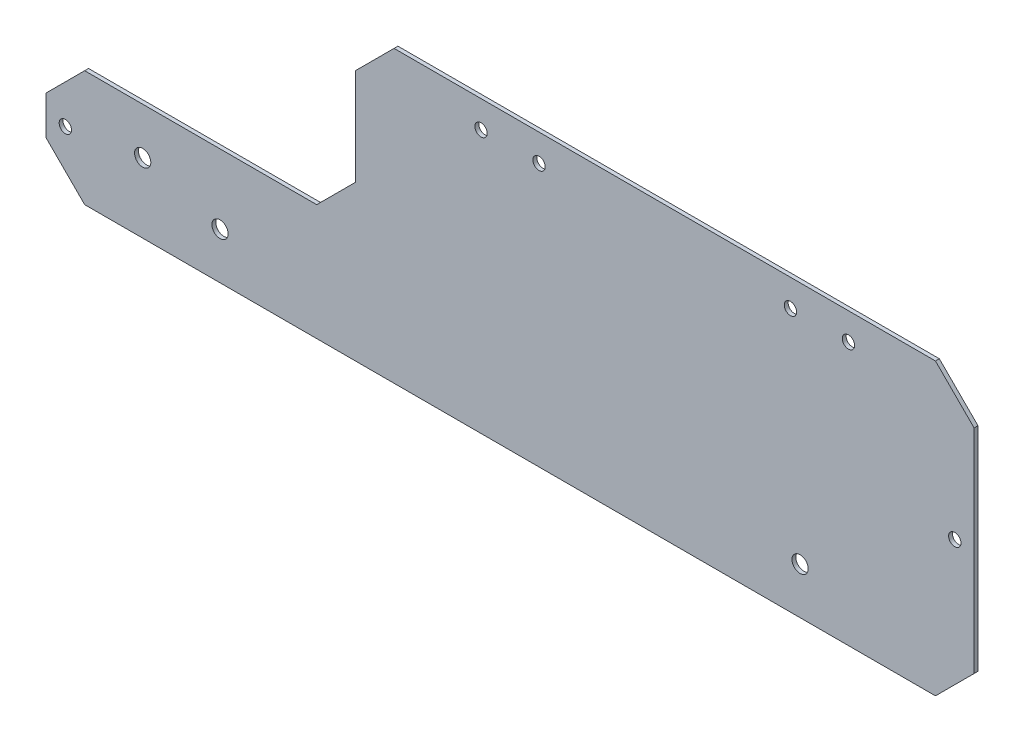
from build123d import *

# Parameters (mm, degrees)
SKETCH_1_W          = 240
SKETCH_1_H          = 75
EXTRUDE_1_DEPTH     = 1
SKETCH_4_W          = 80
SKETCH_4_H          = 45
CUT_EXTRUDE_3_DEPTH = 10
CHAMFER_1_SIZE      = 10
SKETCH_5_R          = 1.6
SKETCH_5_R_2        = 2.1
CUT_EXTRUDE_4_DEPTH = 10


with BuildPart() as part:
    # 草图1 → 凸台-拉伸1 (new body)
    with BuildSketch(Plane.XY):
        with Locations((120, 37.5)):
            Rectangle(SKETCH_1_W, SKETCH_1_H)
    extrude(amount=EXTRUDE_1_DEPTH)

    # 草图4 → 切除-拉伸3 (cut)
    with BuildSketch(Plane(origin=(0, 0, 0), x_dir=(-1, 0, 0), z_dir=(0, 0, -1))):
        with Locations((-40, 52.5)):
            Rectangle(SKETCH_4_W, SKETCH_4_H)
    extrude(amount=-CUT_EXTRUDE_3_DEPTH, mode=Mode.SUBTRACT)

    # 倒角1
    chamfer_1_edges = [part.edges().sort_by_distance(p)[0] for p in [
        (80, 75, 0.5),
        (0, 30, 0.5),
        (80, 30, 0.5),
        (240, 75, 0.5),
        (240, 0, 0.5),
        (0, 0, 0.5),
    ]]
    chamfer(chamfer_1_edges, length=CHAMFER_1_SIZE)

    # 草图5 → 切除-拉伸4 (cut)
    with BuildSketch(Plane(origin=(0, 0, 0), x_dir=(-1, 0, 0), z_dir=(0, 0, -1))):
        with Locations((-5, 15)):
            Circle(SKETCH_5_R)
        with Locations((-195, 12)):
            Circle(SKETCH_5_R_2)
        with Locations((-45, 12)):
            Circle(SKETCH_5_R_2)
        with Locations((-235, 37.5)):
            Circle(SKETCH_5_R)
        with Locations((-207.5, 68)):
            Circle(SKETCH_5_R)
        with Locations((-192.5, 68)):
            Circle(SKETCH_5_R)
        with Locations((-127.5, 68)):
            Circle(SKETCH_5_R)
        with Locations((-112.5, 68)):
            Circle(SKETCH_5_R)
        with Locations((-25, 18)):
            Circle(SKETCH_5_R_2)
    extrude(amount=-CUT_EXTRUDE_4_DEPTH, mode=Mode.SUBTRACT)


solid = part.part
